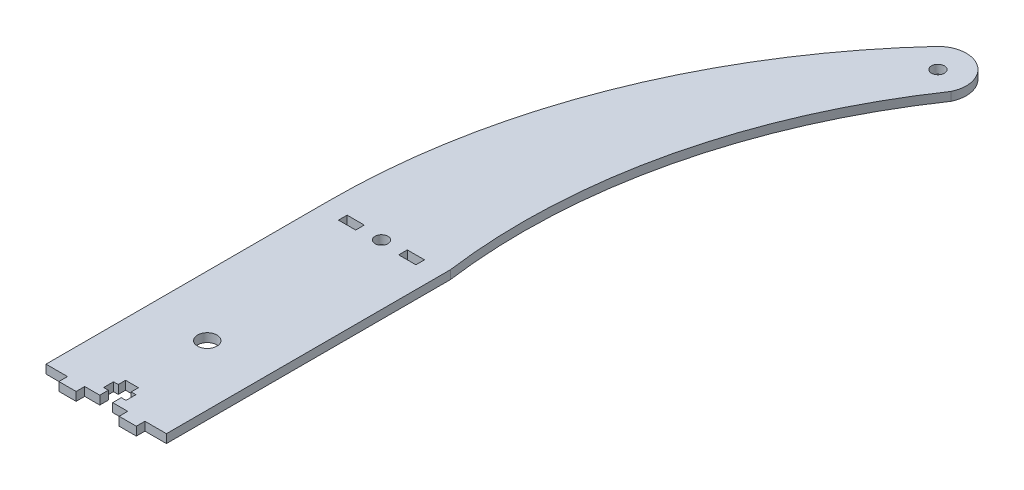
from build123d import *

# Parameters (mm, degrees)
SKETCH1_R           = 1.5
SKETCH1_R_2         = 2.25
SKETCH1_W           = 4
SKETCH1_H           = 2
BOSS_EXTRUDE1_DEPTH = 2
BOSS_EXTRUDE2_DEPTH = 2
SKETCH4_R           = 1.5
CUT_EXTRUDE1_DEPTH  = 2


with BuildPart() as part:
    # Sketch1 → Boss-Extrude1 (new body)
    with BuildSketch(Plane(origin=(0, 0, 0), x_dir=(1, 0, 0), z_dir=(0, 1, 0))):
        Polygon((0, 0), (5, 0), (5, -2), (9, -2), (9, 0), (12.5, 0), (12.5, 2), (11.4, 2), (11.4, 4.3), (12.5, 4.3), (12.5, 6), (15.5, 6), (15.5, 4.3), (16.6, 4.3), (16.6, 2), (15.5, 2), (15.5, 0), (19, 0), (19, -2), (23, -2), (23, 0), (28, 0), (28, 66), (0, 66), align=None)
        with Locations(Location((14, 64, 0), (0, 0, 270))):
            Circle(SKETCH1_R, mode=Mode.SUBTRACT)
        with Locations(Location((14, 23.49, 0), (0, 0, 270))):
            Circle(SKETCH1_R_2, mode=Mode.SUBTRACT)
        with Locations((7, 64)):
            Rectangle(SKETCH1_W, SKETCH1_H, mode=Mode.SUBTRACT)
        with Locations((21, 64)):
            Rectangle(SKETCH1_W, SKETCH1_H, mode=Mode.SUBTRACT)
    extrude(amount=BOSS_EXTRUDE1_DEPTH)

    # Sketch2 → Boss-Extrude2 (add)
    with BuildSketch(Plane(origin=(0, 2, 0), x_dir=(1, 0, 0), z_dir=(0, 1, 0))):
        with BuildLine():
            Line((0, 66), (28, 66))
            ThreePointArc((28, 66), (34.819271185, 129.864214399), (70.378490249, 183.349560802))
            ThreePointArc((70.378490249, 183.349560802), (70.223472253, 188.82876401), (64.776007814, 189.43772177))
            ThreePointArc((64.776007814, 189.43772177), (17.177564343, 135.700793296), (0, 66))
        make_face()
    extrude(amount=-BOSS_EXTRUDE2_DEPTH)

    # Sketch4 → Cut-Extrude1 (cut)
    with BuildSketch(Plane(origin=(0, 2, 0), x_dir=(1, 0, 0), z_dir=(0, 1, 0))):
        with Locations(Location((44.36627387, 163, 0), (0, 0, 270))):
            Circle(SKETCH4_R)
        with BuildLine():
            Line((49.278104547, 158.611243867), (90.336581865, 196.333434103))
            Line((90.336581865, 196.333434103), (75.550012159, 212.427781571))
            Line((75.550012159, 212.427781571), (35.469078733, 175.603702981))
            Line((35.469078733, 175.603702981), (39.454443193, 167.388756133))
            ThreePointArc((39.454443193, 167.388756133), (48.755030003, 167.911830677), (49.278104547, 158.611243867))
        make_face()
    extrude(amount=-CUT_EXTRUDE1_DEPTH, mode=Mode.SUBTRACT)


solid = part.part
